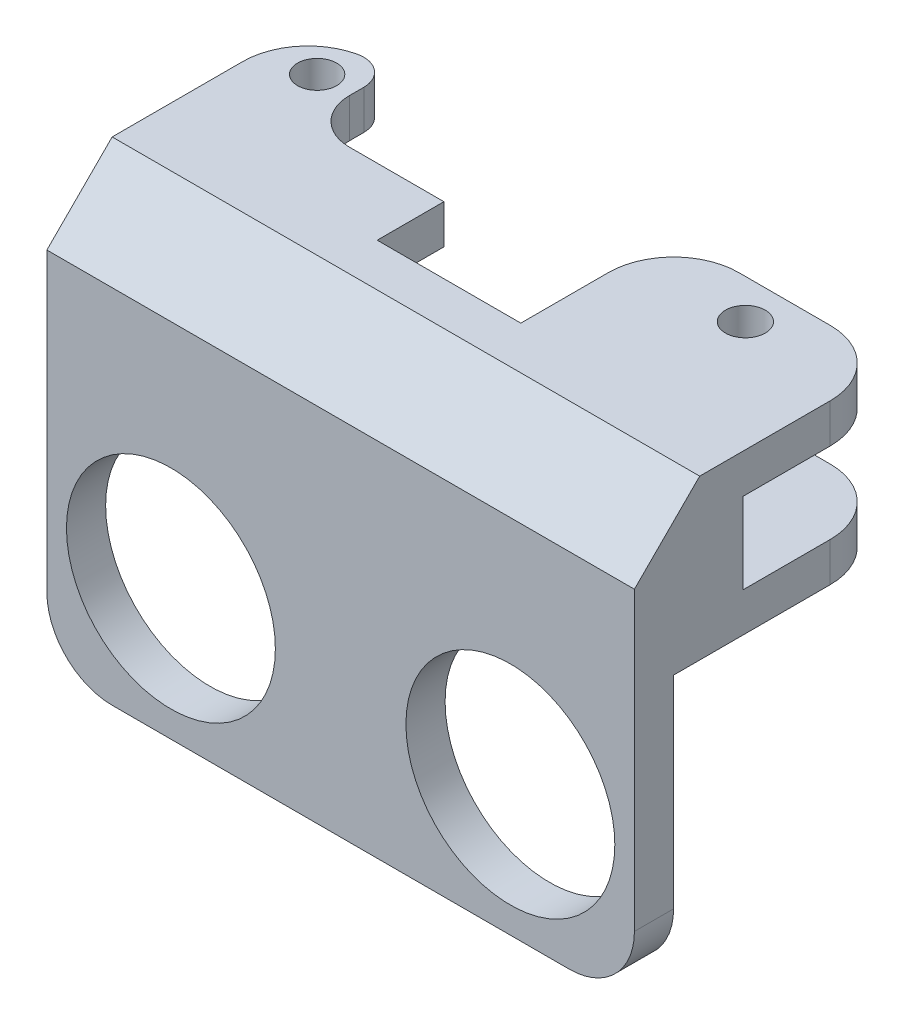
from build123d import *

# Parameters (mm, degrees)
SKETCH1_R           = 8
BOSS_EXTRUDE1_DEPTH = 3
SKETCH2_W           = 17
SKETCH2_H           = 3
BOSS_EXTRUDE2_DEPTH = 17
SKETCH3_W           = 45
SKETCH3_H           = 3
BOSS_EXTRUDE3_DEPTH = 9.2
BOSS_EXTRUDE4_REACH = 41.571
SKETCH4_W           = 5.3
SKETCH4_H           = 3
SKETCH6_W           = 45
SKETCH6_H           = 5.3
BOSS_EXTRUDE5_DEPTH = 9.2
SKETCH7_W           = 17
SKETCH7_H           = 3
BOSS_EXTRUDE6_DEPTH = 11.7
SKETCH8_R           = 1.525
CUT_EXTRUDE1_DEPTH  = 44.180319591
CHAMFER1_SIZE       = 5
FILLET1_R           = 5
SKETCH9_R           = 1.5
SKETCH9_R_2         = 1.525
CUT_EXTRUDE2_DEPTH  = 44.180319591
FILLET2_R           = 2


with BuildPart() as part:
    # Sketch1 → Boss-Extrude1 (new body)
    with BuildSketch(Plane.XY):
        with BuildLine():
            Line((-17.5, -10.5), (17.5, -10.5))
            ThreePointArc((17.5, -10.5), (21.035533906, -9.035533906), (22.5, -5.5))
            Line((22.5, -5.5), (22.5, 10.5))
            Line((22.5, 10.5), (22.5, 13))
            Line((22.5, 13), (-22.5, 13))
            Line((-22.5, 13), (-22.5, 10.5))
            Line((-22.5, 10.5), (-22.5, -5.5))
            ThreePointArc((-22.5, -5.5), (-21.035533906, -9.035533906), (-17.5, -10.5))
        make_face()
        with Locations((13, -0.5)):
            Circle(SKETCH1_R, mode=Mode.SUBTRACT)
        with Locations((-13, -0.5)):
            Circle(SKETCH1_R, mode=Mode.SUBTRACT)
    extrude(amount=BOSS_EXTRUDE1_DEPTH)

    # Sketch2 → Boss-Extrude2 (add)
    with BuildSketch(Plane(origin=(0, 0, 0), x_dir=(-1, 0, 0), z_dir=(0, 0, -1))):
        with Locations((-14, 11.5)):
            Rectangle(SKETCH2_W, SKETCH2_H)
        with Locations((14, 11.5)):
            Rectangle(SKETCH2_W, SKETCH2_H)
    extrude(amount=BOSS_EXTRUDE2_DEPTH)

    # Sketch3 → Boss-Extrude3 (add)
    with BuildSketch(Plane(origin=(0, 13, 0), x_dir=(1, 0, 0), z_dir=(0, 1, 0))):
        with Locations((0, -1.5)):
            Rectangle(SKETCH3_W, SKETCH3_H)
    extrude(amount=BOSS_EXTRUDE3_DEPTH)

    # Sketch4 → Boss-Extrude4 (add, up to next)
    with BuildSketch(Plane(origin=(-5.5, 0, 0), x_dir=(0, 0, -1), z_dir=(1, 0, 0)), mode=Mode.PRIVATE) as boss_extrude4_sk1:
        with Locations((2.65, 11.5)):
            Rectangle(SKETCH4_W, SKETCH4_H)
    boss_extrude4_tool1 = extrude(boss_extrude4_sk1.sketch, amount=BOSS_EXTRUDE4_REACH, mode=Mode.PRIVATE) - part.part
    add(boss_extrude4_tool1.solids().sort_by_distance((-5.5, 11.5, -2.65))[0])

    # Sketch6 → Boss-Extrude5 (add)
    with BuildSketch(Plane(origin=(0, 13, 0), x_dir=(1, 0, 0), z_dir=(0, 1, 0))):
        with Locations((0, 2.65)):
            Rectangle(SKETCH6_W, SKETCH6_H)
    extrude(amount=BOSS_EXTRUDE5_DEPTH)

    # Sketch7 → Boss-Extrude6 (add, through all)
    with BuildSketch(Plane(origin=(0, 0, -5.3), x_dir=(-1, 0, 0), z_dir=(0, 0, -1))):
        with Locations((-14, 20.7)):
            Rectangle(SKETCH7_W, SKETCH7_H)
        with Locations((14, 20.7)):
            Rectangle(SKETCH7_W, SKETCH7_H)
    extrude(amount=BOSS_EXTRUDE6_DEPTH)

    # Sketch8 → Cut-Extrude1 (cut, through all)
    with BuildSketch(Plane(origin=(0, 22.2, 0), x_dir=(1, 0, 0), z_dir=(0, 1, 0))):
        with Locations(Location((14, 14, 0), (0, 0, 270))):
            Circle(SKETCH8_R)
        with Locations(Location((-14, 14, 0), (0, 0, 270))):
            Circle(SKETCH8_R)
    extrude(amount=-CUT_EXTRUDE1_DEPTH, mode=Mode.SUBTRACT)

    # Chamfer1
    chamfer1_edges = [part.edges().sort_by_distance(p)[0] for p in [
        (0, 22.2, 3),
    ]]
    chamfer(chamfer1_edges, length=CHAMFER1_SIZE)

    # Fillet1
    fillet1_edges = [part.edges().sort_by_distance(p)[0] for p in [
        (22.5, 20.7, -17),
        (5.5, 20.7, -17),
        (-22.5, 20.7, -17),
        (-5.5, 20.7, -17),
        (5.5, 11.5, -17),
        (22.5, 11.5, -17),
        (-5.5, 11.5, -17),
        (-22.5, 11.5, -17),
    ]]
    fillet(fillet1_edges, radius=FILLET1_R)

    # Sketch9 → Cut-Extrude2 (cut, through all)
    # profile 1 of 2: a face of its own
    with BuildSketch(Plane(origin=(0, 22.2, 0), x_dir=(1, 0, 0), z_dir=(0, 1, 0))):
        with Locations(Location((-18.8, 14, 0), (0, 0, 270))):
            Circle(SKETCH9_R)
    # profile 2 of 2: a face of its own
    with BuildSketch(Plane(origin=(0, 22.2, 0), x_dir=(1, 0, 0), z_dir=(0, 1, 0))):
        with BuildLine():
            Line((-5.5, 10.41), (-12.349475382, 10.41))
            Line((-12.349475382, 10.41), (-12.849475382, 10.41))
            ThreePointArc((-12.849475382, 10.41), (-15.194497894, 11.45415993), (-16.156081538, 13.834235021))
            Line((-16.156081538, 13.834235021), (-16.156081538, 17))
            Line((-16.156081538, 17), (-10.5, 17))
            ThreePointArc((-10.5, 17), (-6.964466094, 15.535533906), (-5.5, 12))
            Line((-5.5, 12), (-5.5, 10.41))
        make_face()
        with Locations((-14, 14)):
            Circle(SKETCH9_R_2, mode=Mode.SUBTRACT)
    extrude(amount=-CUT_EXTRUDE2_DEPTH, mode=Mode.SUBTRACT)

    # Fillet2
    fillet2_edges = [part.edges().sort_by_distance(p)[0] for p in [
        (-16.156081538, 20.7, -17),
        (-16.156081538, 11.5, -17),
    ]]
    fillet(fillet2_edges, radius=FILLET2_R)


solid = part.part
